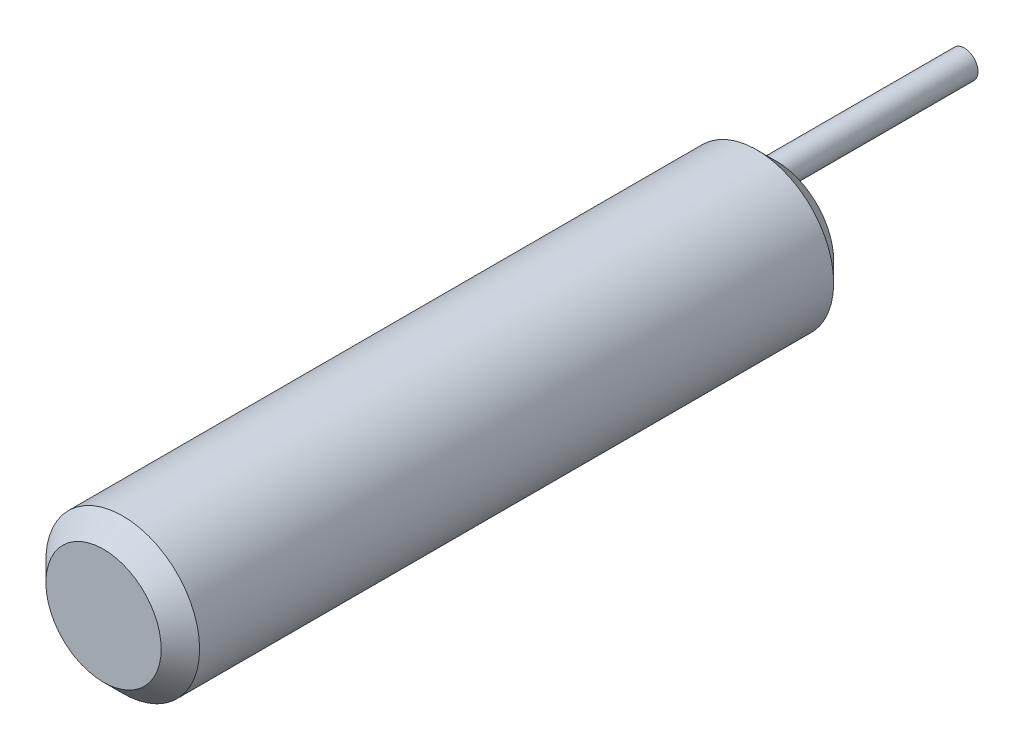
from build123d import *

# Parameters (mm, degrees)
SKETCH_1_R      = 4
EXTRUDE_1_DEPTH = 35
CHAMFER_1_SIZE  = 1
SKETCH_2_R      = 0.713157814
EXTRUDE_2_DEPTH = 10


with BuildPart() as part:
    # Эскиз1 → Бобышка-Вытянуть1 (new body)
    with BuildSketch(Plane.XY):
        Circle(SKETCH_1_R)
    extrude(amount=EXTRUDE_1_DEPTH)

    # Фаска1
    chamfer_1_edges = [part.edges().sort_by_distance(p)[0] for p in [
        (-4, 0, 0),
        (-4, 0, 35),
    ]]
    chamfer(chamfer_1_edges, length=CHAMFER_1_SIZE)

    # Эскиз2 → Бобышка-Вытянуть2 (add)
    with BuildSketch(Plane(origin=(0, 0, 0), x_dir=(-1, 0, 0), z_dir=(0, 0, -1))):
        with Locations(Location((0.200233265, 2.278059223, 0), (0, 0, 84.976815207))):
            Circle(SKETCH_2_R)
    extrude(amount=EXTRUDE_2_DEPTH)


solid = part.part
